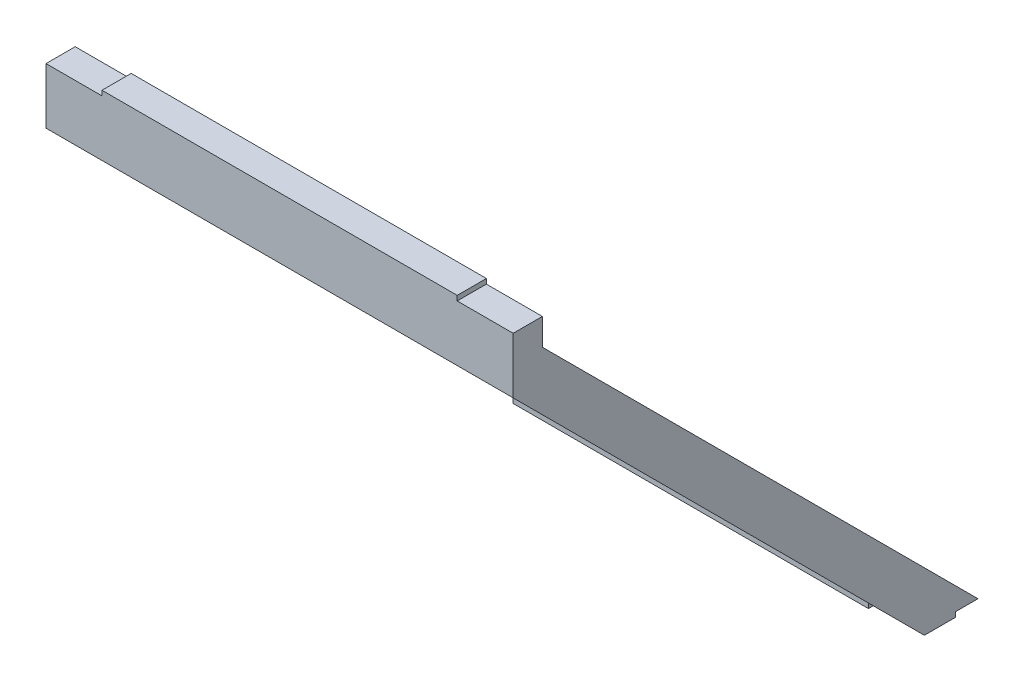
from build123d import *

# Parameters (mm, degrees)
SKETCH1_W            = 96
SKETCH1_H            = 11.5
BOSS_EXTRUDE1_DEPTH  = 1
BOSS_EXTRUDE2_DEPTH  = 96
SKETCH3_W            = 100.030166713
SKETCH3_H            = 53.267661774
CUT_EXTRUDE1_DEPTH   = 96
SKETCH4_W            = 73
SKETCH4_H            = 1
BOSS_EXTRUDE3_DEPTH  = 1
SKETCH5_W            = 73
SKETCH5_H            = 1
BOSS_EXTRUDE4_DEPTH  = 5
SKETCH6_W            = 13
SKETCH6_H            = 1
BOSS_EXTRUDE6_DEPTH  = 5
SKETCH7_W            = 13
SKETCH7_H            = 1
BOSS_EXTRUDE7_DEPTH  = 5
BOSS_EXTRUDE8_DEPTH  = 96
SKETCH10_W           = 73
SKETCH10_H           = 6.414213562
BOSS_EXTRUDE9_DEPTH  = 1
BOSS_EXTRUDE10_DEPTH = 1
BOSS_EXTRUDE11_DEPTH = 1
SKETCH13_R           = 45
SKETCH13_R_2         = 40
SKETCH13_R_3         = 32.5
SKETCH13_R_4         = 27.5
SKETCH13_R_5         = 20
SKETCH13_R_6         = 15
CUT_EXTRUDE2_DEPTH   = 10
BOSS_EXTRUDE12_DEPTH = 1
CIRPATTERN1_COUNT    = 4
BOSS_EXTRUDE14_DEPTH = 1
CIRPATTERN2_COUNT    = 4
BOSS_EXTRUDE15_DEPTH = 1
CIRPATTERN3_COUNT    = 4


with BuildPart() as part:
    # Sketch1 → Boss-Extrude1 (new body)
    with BuildSketch(Plane.XY):
        with Locations((48, 5.75)):
            Rectangle(SKETCH1_W, SKETCH1_H)
    extrude(amount=BOSS_EXTRUDE1_DEPTH)

    # Sketch2 → Boss-Extrude2 (add)
    with BuildSketch(Plane.ZY):
        Polygon((1, 0), (-86.974134086, -87.974134086), (-87.681240867, -87.267027305), (0, 0.414213562), align=None)
    extrude(amount=-BOSS_EXTRUDE2_DEPTH)

    # Sketch3 → Cut-Extrude1 (cut)
    with BuildSketch(Plane.ZY):
        with Locations((-50.015083356, -111.133830887)):
            Rectangle(SKETCH3_W, SKETCH3_H)
    extrude(amount=-CUT_EXTRUDE1_DEPTH, mode=Mode.SUBTRACT)

    # Sketch4 → Boss-Extrude3 (add)
    with BuildSketch(Plane(origin=(0, 11.5, 0), x_dir=(1, 0, 0), z_dir=(0, 1, 0))):
        with Locations((48, -0.5)):
            Rectangle(SKETCH4_W, SKETCH4_H)
    extrude(amount=BOSS_EXTRUDE3_DEPTH)

    # Sketch5 → Boss-Extrude4 (add)
    with BuildSketch(Plane(origin=(0, 0, 0), x_dir=(-1, 0, 0), z_dir=(0, 0, -1))):
        with Locations((-48, 12)):
            Rectangle(SKETCH5_W, SKETCH5_H)
    extrude(amount=BOSS_EXTRUDE4_DEPTH)

    # Sketch6 → Boss-Extrude6 (add)
    with BuildSketch(Plane(origin=(0, 0, 0), x_dir=(-1, 0, 0), z_dir=(0, 0, -1))):
        with Locations((-6.5, 11)):
            Rectangle(SKETCH6_W, SKETCH6_H)
    extrude(amount=BOSS_EXTRUDE6_DEPTH)

    # Sketch7 → Boss-Extrude7 (add)
    with BuildSketch(Plane(origin=(0, 0, 0), x_dir=(-1, 0, 0), z_dir=(0, 0, -1))):
        with Locations((-89.5, 11)):
            Rectangle(SKETCH7_W, SKETCH7_H)
    extrude(amount=BOSS_EXTRUDE7_DEPTH)

    # Sketch8 → Boss-Extrude8 (add)
    with BuildSketch(Plane(origin=(96, 0, 0), x_dir=(0, 0, -1), z_dir=(1, 0, 0))):
        Polygon((83.5, -84.5), (89.914213562, -84.5), (89.914213562, -83.5), (82.5, -83.5), align=None)
    extrude(amount=-BOSS_EXTRUDE8_DEPTH)

    # Sketch10 → Boss-Extrude9 (add)
    with BuildSketch(Plane.XZ.offset(84.5)):
        with Locations((48, -86.707106781)):
            Rectangle(SKETCH10_W, SKETCH10_H)
    extrude(amount=BOSS_EXTRUDE9_DEPTH)

    # Sketch11 → Boss-Extrude10 (add)
    with BuildSketch(Plane.ZY):
        Polygon((-5, 10.5), (-5, 6.02081528), (-94.52081528, -83.5), (-83.914213562, -83.5), (0, 0.414213562), (0, 10.5), align=None)
    extrude(amount=-BOSS_EXTRUDE10_DEPTH)

    # Sketch12 → Boss-Extrude11 (add)
    with BuildSketch(Plane(origin=(96, 0, 0), x_dir=(0, 0, -1), z_dir=(1, 0, 0))):
        Polygon((5, 10.5), (0, 10.5), (0, 0.414213562), (83.914213562, -83.5), (94.52081528, -83.5), (5, 6.02081528), align=None)
    extrude(amount=-BOSS_EXTRUDE11_DEPTH)

    # Sketch13 → Cut-Extrude2 (cut)
    # profile 1 of 3: a face of its own
    with BuildSketch(Plane(origin=(0, -0.5, 0.5), x_dir=(1, 0, 0), z_dir=(0, -0.7071067811865486, 0.7071067811865465))):
        with Locations(Location((48, -59.042893219, 0), (0, 0, 270))):
            Circle(SKETCH13_R)
        with Locations(Location((48, -59.042893219, 0), (0, 0, 270))):
            Circle(SKETCH13_R_2, mode=Mode.SUBTRACT)
    # profile 2 of 3: a face of its own
    with BuildSketch(Plane(origin=(0, -0.5, 0.5), x_dir=(1, 0, 0), z_dir=(0, -0.7071067811865486, 0.7071067811865465))):
        with Locations(Location((48, -59.042893219, 0), (0, 0, 270))):
            Circle(SKETCH13_R_3)
        with Locations(Location((48, -59.042893219, 0), (0, 0, 270))):
            Circle(SKETCH13_R_4, mode=Mode.SUBTRACT)
    # profile 3 of 3: a face of its own
    with BuildSketch(Plane(origin=(0, -0.5, 0.5), x_dir=(1, 0, 0), z_dir=(0, -0.7071067811865486, 0.7071067811865465))):
        with Locations(Location((48, -59.042893219, 0), (0, 0, 270))):
            Circle(SKETCH13_R_5)
        with Locations(Location((48, -59.042893219, 0), (0, 0, 270))):
            Circle(SKETCH13_R_6, mode=Mode.SUBTRACT)
    extrude(amount=-CUT_EXTRUDE2_DEPTH, mode=Mode.SUBTRACT)


with BuildPart() as cut_extrude2_piece_1:
    # of the separate pieces the step leaves, piece 1, a body of its own (cut_extrude2_pieces)
    add(part.part.solids().sort_by_distance((0, 11.5, 1))[0])



with BuildPart() as cut_extrude2_piece_2:
    # of the separate pieces the step leaves, piece 2, a body of its own (cut_extrude2_pieces)
    add(part.part.solids().sort_by_distance((48, -70.533901423, -69.533901423))[0])


with BuildPart() as cut_extrude2_piece_3:
    # of the separate pieces the step leaves, piece 3, a body of its own (cut_extrude2_pieces)
    add(part.part.solids().sort_by_distance((48, -61.695066659, -60.695066659))[0])



with BuildPart() as cut_extrude2_piece_4:
    # of the separate pieces the step leaves, piece 4, a body of its own (cut_extrude2_pieces)
    add(part.part.solids().sort_by_distance((48, -52.856231894, -51.856231894))[0])


with BuildPart() as cut_extrude2_piece_1_1:
    add(cut_extrude2_piece_1.part)

    add(cut_extrude2_piece_2.part)  # Boss-Extrude12 merges Cut-Extrude2 piece 2
    # Sketch14 → Boss-Extrude12 (add)
    with BuildSketch(Plane(origin=(0, -0.5, 0.5), x_dir=(1, 0, 0), z_dir=(0, -0.7071067811865486, 0.7071067811865465))):
        with BuildLine():
            Line((45.5, -103.973395108), (45.5, -98.964691775))
            ThreePointArc((45.5, -98.964691775), (48, -99.042893219), (50.5, -98.964691775))
            Line((50.5, -98.964691775), (50.5, -103.973395108))
            ThreePointArc((50.5, -103.973395108), (48, -104.042893219), (45.5, -103.973395108))
        make_face()
    boss_extrude12 = extrude(amount=-BOSS_EXTRUDE12_DEPTH)

    # CirPattern1: Boss-Extrude12 ×4 about axis
    cirpattern1_axis = Axis((48, -41.749630176, -41.749630176), (0, -0.7071067811865476, 0.7071067811865476))
    for i in range(1, CIRPATTERN1_COUNT):
        add(boss_extrude12.rotate(cirpattern1_axis, i * 360 / CIRPATTERN1_COUNT))



with BuildPart() as cut_extrude2_piece_3_1:
    add(cut_extrude2_piece_3.part)

    add(cut_extrude2_piece_4.part)  # Boss-Extrude14 merges Cut-Extrude2 piece 4
    # Sketch16 → Boss-Extrude14 (add)
    with BuildSketch(Plane(origin=(0, -0.5, 0.5), x_dir=(1, 0, 0), z_dir=(0, -0.7071067811865486, 0.7071067811865465))):
        with BuildLine():
            Line((45.5, -73.833092677), (45.5, -78.886028052))
            ThreePointArc((45.5, -78.886028052), (48, -79.042893219), (50.5, -78.886028052))
            Line((50.5, -78.886028052), (50.5, -73.833092677))
            ThreePointArc((50.5, -73.833092677), (48, -74.042893219), (45.5, -73.833092677))
        make_face()
    boss_extrude14 = extrude(amount=-BOSS_EXTRUDE14_DEPTH)

    # CirPattern2: Boss-Extrude14 ×4 about axis
    cirpattern2_axis = Axis((48, -41.749630176, -41.749630176), (0, -0.7071067811865476, 0.7071067811865476))
    for i in range(1, CIRPATTERN2_COUNT):
        add(boss_extrude14.rotate(cirpattern2_axis, i * 360 / CIRPATTERN2_COUNT))


with BuildPart() as cut_extrude2_piece_1_2:
    add(cut_extrude2_piece_1_1.part)

    add(cut_extrude2_piece_3_1.part)  # Boss-Extrude15 merges Cut-Extrude2 piece 3
    # Sketch17 → Boss-Extrude15 (add)
    with BuildSketch(Plane(origin=(0, -0.5, 0.5), x_dir=(1, 0, 0), z_dir=(0, -0.7071067811865486, 0.7071067811865465))):
        with BuildLine():
            Line((25.434059771, -43.325757934), (21.851195056, -39.742893219))
            ThreePointArc((21.851195056, -39.742893219), (23.413288551, -37.788631996), (25.121081398, -35.960322227))
            Line((25.121081398, -35.960322227), (28.656656321, -39.49589715))
            ThreePointArc((28.656656321, -39.49589715), (26.958042443, -41.337356735), (25.434059771, -43.325757934))
        make_face()
    boss_extrude15 = extrude(amount=-BOSS_EXTRUDE15_DEPTH)

    # CirPattern3: Boss-Extrude15 ×4 about axis
    cirpattern3_axis = Axis((48, -41.749630176, -41.749630176), (0, -0.7071067811865487, 0.7071067811865465))
    for i in range(1, CIRPATTERN3_COUNT):
        add(boss_extrude15.rotate(cirpattern3_axis, i * 360 / CIRPATTERN3_COUNT))


solid = cut_extrude2_piece_1_2.part
